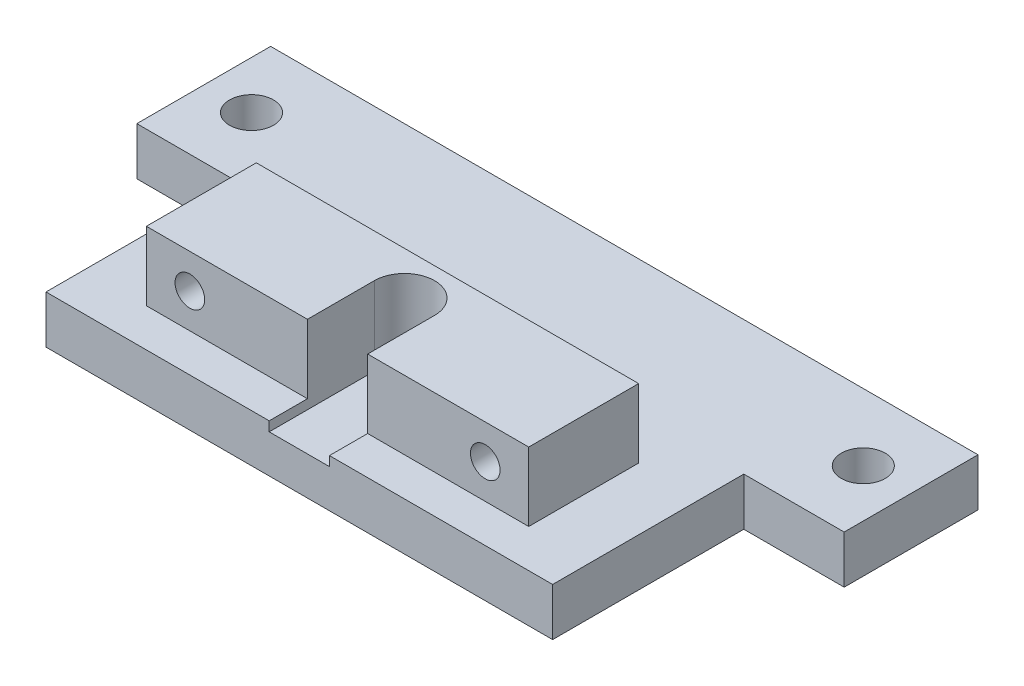
from build123d import *

# Parameters (mm, degrees)
SKETCH1_W           = 74
SKETCH1_H           = 14
SKETCH1_R           = 2.3
SKETCH1_W_2         = 53
SKETCH1_H_2         = 20
BOSS_EXTRUDE1_DEPTH = 5.2
CUT_EXTRUDE1_DEPTH  = 1
BOSS_EXTRUDE2_START = 7.2
BOSS_EXTRUDE2_DEPTH = 7.2
SKETCH5_R           = 1.55
CUT_EXTRUDE2_DEPTH  = 78.278781046
SKETCH6_W           = 34
SKETCH6_H           = 0.2
CUT_EXTRUDE3_DEPTH  = 78.651529283


with BuildPart() as part:
    # Sketch1 → Boss-Extrude1 (new body)
    # profile 1 of 2: a face of its own
    with BuildSketch(Plane(origin=(0, 0, 0), x_dir=(1, 0, 0), z_dir=(0, 1, 0))):
        with Locations((37, 7)):
            Rectangle(SKETCH1_W, SKETCH1_H)
        with Locations(Location((5, 7, 0), (0, 0, 270))):
            Circle(SKETCH1_R, mode=Mode.SUBTRACT)
        with Locations(Location((69, 7, 0), (0, 0, 270))):
            Circle(SKETCH1_R, mode=Mode.SUBTRACT)
    # profile 2 of 2: a face of its own
    with BuildSketch(Plane(origin=(0, 0, 0), x_dir=(1, 0, 0), z_dir=(0, 1, 0))):
        with Locations((37, -10)):
            Rectangle(SKETCH1_W_2, SKETCH1_H_2)
    extrude(amount=BOSS_EXTRUDE1_DEPTH)

    # Sketch2 → Cut-Extrude1 (cut)
    with BuildSketch(Plane(origin=(0, 5.2, 0), x_dir=(1, 0, 0), z_dir=(0, 1, 0))):
        with BuildLine():
            ThreePointArc((37, -5.85), (34.772613639, -6.772613639), (33.85, -9))
            Line((33.85, -9), (33.85, -20))
            Line((33.85, -20), (40.15, -20))
            Line((40.15, -20), (40.15, -9))
            ThreePointArc((40.15, -9), (39.227386361, -6.772613639), (37, -5.85))
        make_face()
    extrude(amount=-CUT_EXTRUDE1_DEPTH, mode=Mode.SUBTRACT)

    # Sketch3 → Boss-Extrude2 (add)
    with BuildSketch(Plane(origin=(0, 5.2, 0), x_dir=(1, 0, 0), z_dir=(0, 1, 0)).offset(BOSS_EXTRUDE2_START)):
        with BuildLine():
            Line((33.85, -9), (33.85, -16))
            Line((33.85, -16), (17, -16))
            Line((17, -16), (17, -4.5))
            Line((17, -4.5), (57, -4.5))
            Line((57, -4.5), (57, -16))
            Line((57, -16), (40.15, -16))
            Line((40.15, -16), (40.15, -9))
            ThreePointArc((40.15, -9), (37, -5.85), (33.85, -9))
        make_face()
    extrude(amount=-BOSS_EXTRUDE2_DEPTH)

    # Sketch5 → Cut-Extrude2 (cut, through all)
    with BuildSketch(Plane(origin=(0, 0, 4.5), x_dir=(-1, 0, 0), z_dir=(0, 0, -1))):
        with Locations((-52.45, 8.8)):
            Circle(SKETCH5_R)
        with Locations((-21.55, 8.8)):
            Circle(SKETCH5_R)
    extrude(amount=-CUT_EXTRUDE2_DEPTH, mode=Mode.SUBTRACT)

    # Sketch6 → Cut-Extrude3 (cut, through all)
    with BuildSketch(Plane.ZY):
        with Locations((3, 0.1)):
            Rectangle(SKETCH6_W, SKETCH6_H)
    extrude(amount=-CUT_EXTRUDE3_DEPTH, mode=Mode.SUBTRACT)


solid = part.part
